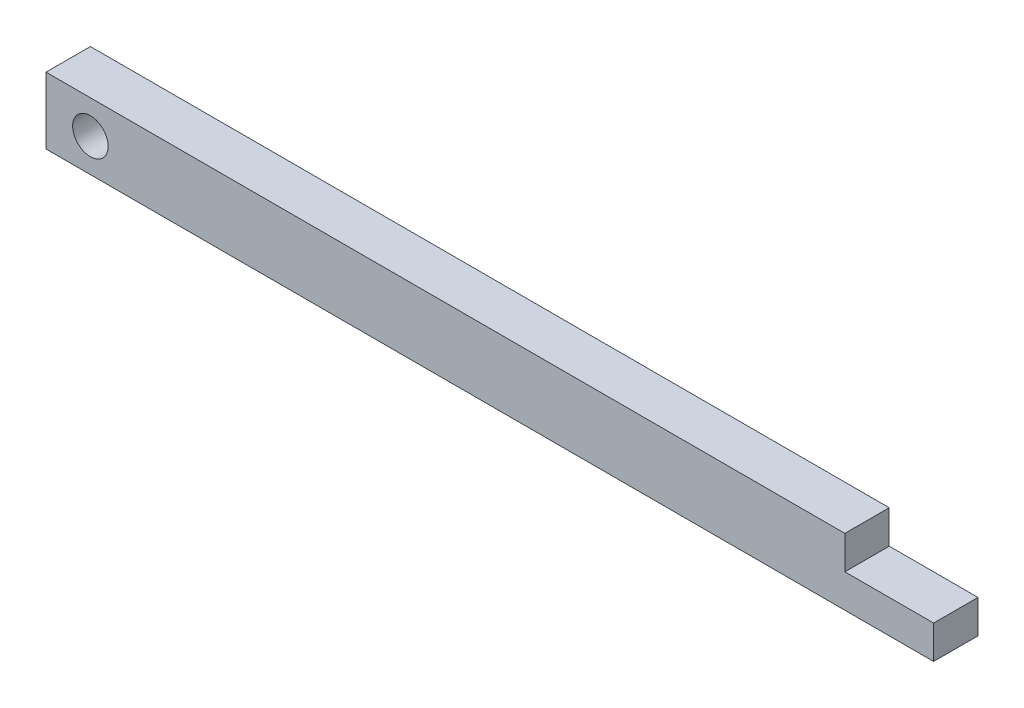
from build123d import *

# Parameters (mm, degrees)
BOSS_EXTRUDE1_DEPTH = 10
SKETCH3_R           = 4
CUT_EXTRUDE1_DEPTH  = 10


with BuildPart() as part:
    # Sketch1 → Boss-Extrude1 (new body)
    with BuildSketch(Plane.XY):
        Polygon((200, 7.5), (180, 7.5), (180, 15), (0, 15), (0, 0), (200, 0), align=None)
    extrude(amount=BOSS_EXTRUDE1_DEPTH)

    # Sketch3 → Cut-Extrude1 (cut)
    with BuildSketch(Plane.XY.offset(10)):
        with Locations((10, 7.5)):
            Circle(SKETCH3_R)
    extrude(amount=-CUT_EXTRUDE1_DEPTH, mode=Mode.SUBTRACT)


solid = part.part
